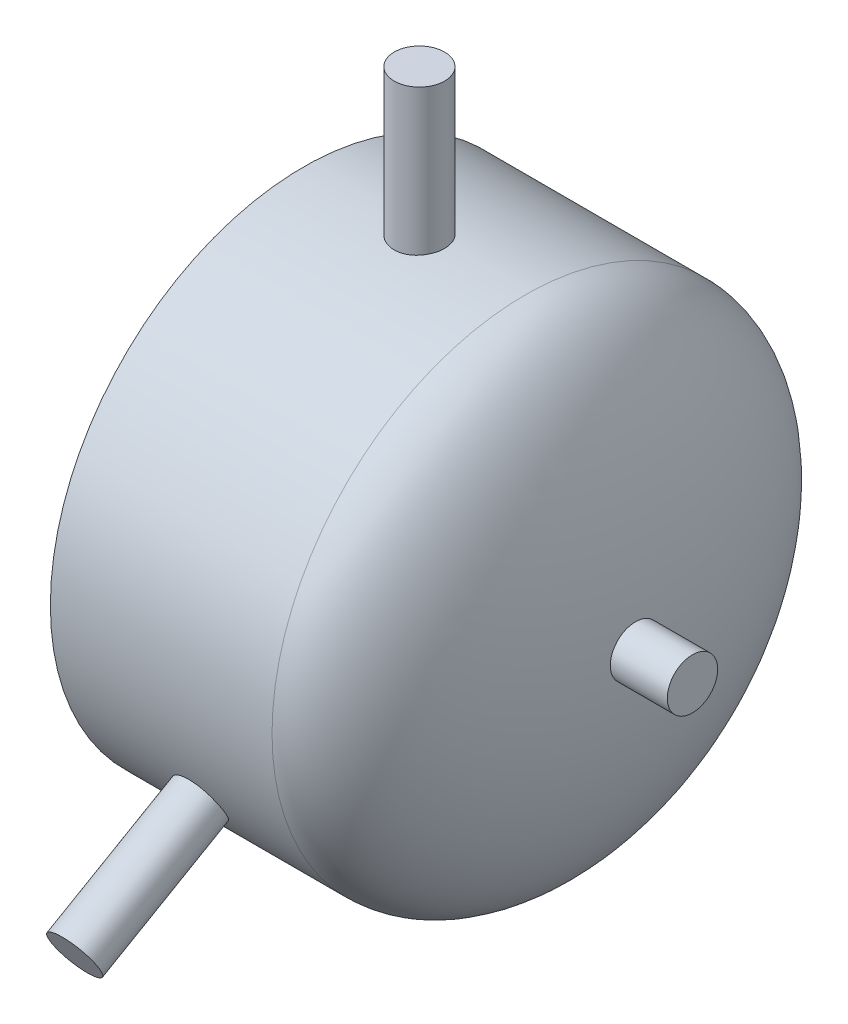
from build123d import *

# Parameters (mm, degrees)
SKETCH2_W         = 6.35
SKETCH2_H         = 42.418
CIRPATTERN1_COUNT = 3
SKETCH3_W         = 18.034
SKETCH3_H         = 6.35


with BuildPart() as part:
    # Sketch1 → Revolve1 (revolve)
    with BuildSketch(Plane.XY):
        with BuildLine():
            Line((35.1282, 0), (41.91, 0))
            add(Edge.make_bspline(
                [(13.97, -63.8175), (41.91, -63.8175), (41.91, 0)],
                knots=[3.141592654, 3.141592654, 3.141592654, 4.71238898, 4.71238898, 4.71238898], degree=2, weights=[1, 0.707106781, 1]))
            Line((13.97, -63.8175), (-41.91, -63.8175))
            Line((-41.91, -63.8175), (-41.91, -57.3786))
            Line((-41.91, -57.3786), (13.97, -57.0357))
            add(Edge.make_bspline(
                [(13.97, -57.0357), (35.1282, -57.0357), (35.1282, 0)],
                knots=[0, 0, 0, 1.570796327, 1.570796327, 1.570796327], degree=2, weights=[1, 0.707106781, 1]))
        make_face()
    revolve(axis=Axis((-41.91, 0, 0), (1, 0, 0)))


with BuildPart() as body_2:
    # Sketch2 → Revolve2 (revolve)
    with BuildSketch(Plane.XY):
        with Locations((-15.875, 79.121)):
            Rectangle(SKETCH2_W, SKETCH2_H)
    revolve(axis=Axis((-12.7, -906.949839724, 0), (0, 1, 0)))


with BuildPart() as cirpattern1_1:
    # CirPattern1: pattern copy
    add(body_2.part.rotate(Axis((-46.101, 0, 0), (1, 0, 0)), 1 * 360 / CIRPATTERN1_COUNT))


with BuildPart() as cirpattern1_2:
    # CirPattern1: pattern copy
    add(body_2.part.rotate(Axis((-46.101, 0, 0), (1, 0, 0)), 2 * 360 / CIRPATTERN1_COUNT))


with BuildPart() as body_5:
    # Sketch3 → Revolve3 (revolve)
    with BuildSketch(Plane.XY):
        with Locations((47.117, 3.175)):
            Rectangle(SKETCH3_W, SKETCH3_H)
    revolve(axis=Axis((-1078.063901148, 0, 0), (1, 0, 0)))


solid = Compound([part.part, body_2.part, cirpattern1_1.part, cirpattern1_2.part, body_5.part])
